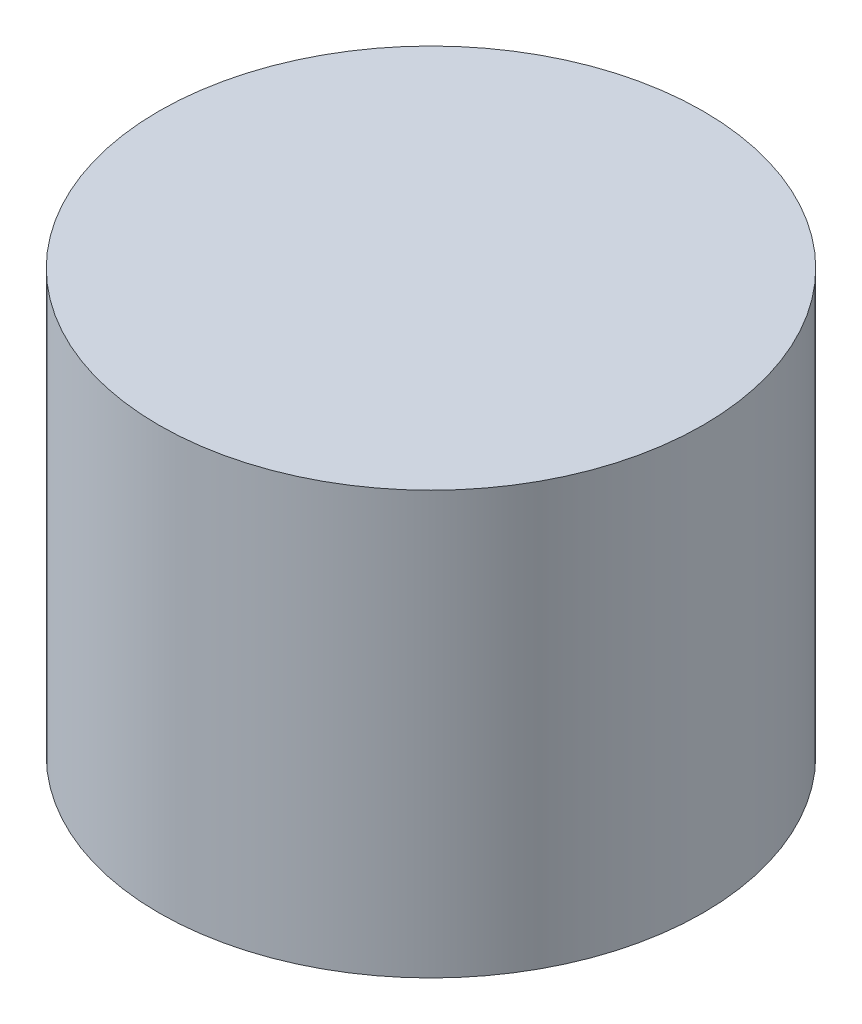
from build123d import *

# Parameters (mm, degrees)
SKETCH_1_W = 1.9
SKETCH_1_H = 2.95


with BuildPart() as part:
    # 草图1 → 旋转1 (revolve)
    with BuildSketch(Plane(origin=(0, 0, 0), x_dir=(-1, 0, 0), z_dir=(0, 0, -1)), mode=Mode.PRIVATE) as revolve_1_sk:
        with Locations((-0.95, 1.475)):
            Rectangle(SKETCH_1_W, SKETCH_1_H)
    revolve(revolve_1_sk.sketch.rotate(Axis((0, 0, 0), (0, 1, 0)), 270), axis=Axis((0, 0, 0), (0, 1, 0)))


solid = part.part
